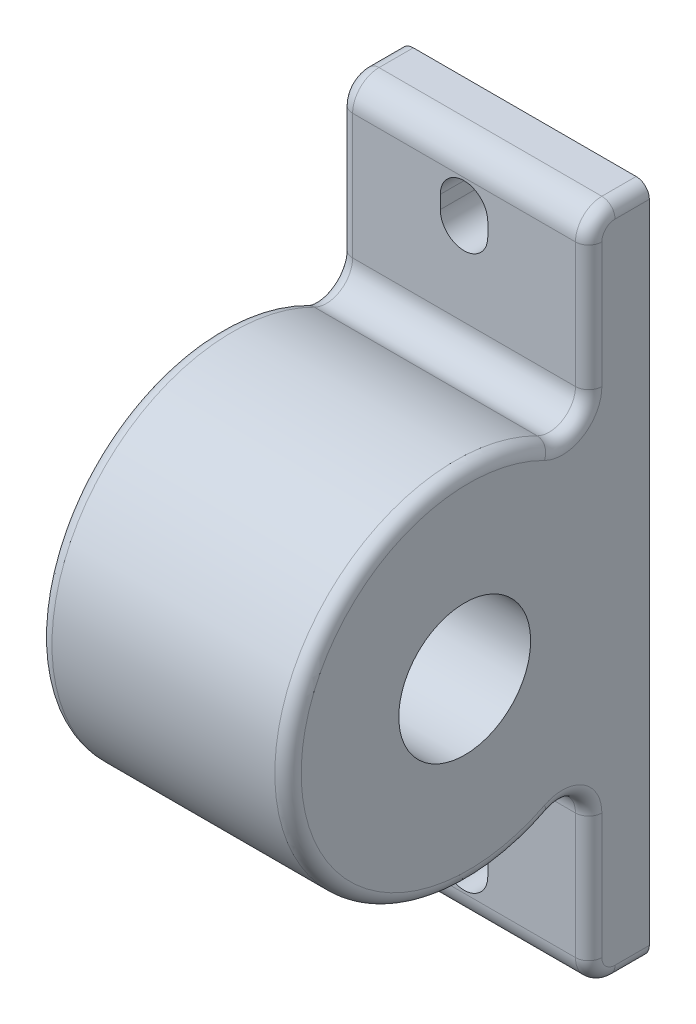
from build123d import *

# Parameters (mm, degrees)
SKETCH_1_W          = 94.5
SKETCH_1_H          = 255
EXTRUDE_1_DEPTH     = 137
SKETCH_2_OUTSIDE_W  = 199.902
SKETCH_2_OUTSIDE_H  = 317.902
CUT_EXTRUDE_1_DEPTH = 137
FILLET_1_R          = 10
FILLET_2_R          = 5
SKETCH_3_R          = 25
CUT_EXTRUDE_2_DEPTH = 210.655670133
CUT_EXTRUDE_3_DEPTH = 23


with BuildPart() as part:
    # 草图1 → 凸台-拉伸1 (new body)
    with BuildSketch(Plane.XY):
        Rectangle(SKETCH_1_W, SKETCH_1_H)
    extrude(amount=EXTRUDE_1_DEPTH)

    # 草图2 outside → 切除-拉伸1 (cut)
    with BuildSketch(Plane(origin=(47.25, 0, 0), x_dir=(0, 0, -1), z_dir=(1, 0, 0))):
        with Locations((-68.5, 0)):
            Rectangle(SKETCH_2_OUTSIDE_W, SKETCH_2_OUTSIDE_H)
        with BuildLine():
            Line((0, -127.5), (0, 127.5))
            Line((0, 127.5), (-23, 127.5))
            Line((-23, 127.5), (-23, 51.205468458))
            ThreePointArc((-23, 51.205468458), (-137, 0), (-23, -51.205468458))
            Line((-23, -51.205468458), (-23, -127.5))
            Line((-23, -127.5), (0, -127.5))
        make_face(mode=Mode.SUBTRACT)
    extrude(amount=-CUT_EXTRUDE_1_DEPTH, mode=Mode.SUBTRACT)

    # 圆角1
    fillet_1_edges = [part.edges().sort_by_distance(p)[0] for p in [
        (0, 127.5, 23),
        (0, -51.205468458, 23),
        (0, 51.205468458, 23),
        (0, -127.5, 23),
    ]]
    fillet(fillet_1_edges, radius=FILLET_1_R)

    # 圆角2
    fillet_2_edges = [part.edges().sort_by_distance(p)[0] for p in [
        (47.25, 127.5, 6.5),
        (-47.25, 127.5, 6.5),
        (47.25, -93.757142128, 23),
        (47.25, -127.5, 6.5),
        (47.25, 93.757142128, 23),
        (47.25, 0, 137),
        (47.25, -124.571067812, 20.071067812),
        (47.25, 124.571067812, 20.071067812),
        (-47.25, 93.757142128, 23),
        (-47.25, -93.757142128, 23),
        (-47.25, 0, 137),
        (-47.25, -127.5, 6.5),
        (-47.25, -124.571067812, 20.071067812),
        (-47.25, 124.571067812, 20.071067812),
        (47.25, 61.493048139, 27.766594318),
        (-47.25, 61.493048139, 27.766594318),
        (47.25, -61.493048139, 27.766594318),
        (-47.25, -61.493048139, 27.766594318),
    ]]
    fillet(fillet_2_edges, radius=FILLET_2_R)

    # 草图3 → 切除-拉伸2 (cut, through all)
    with BuildSketch(Plane(origin=(47.25, 0, 0), x_dir=(0, 0, -1), z_dir=(1, 0, 0))):
        with Locations((-70, 0)):
            Circle(SKETCH_3_R)
    extrude(amount=-CUT_EXTRUDE_2_DEPTH, mode=Mode.SUBTRACT)

    # 草图4 → 切除-拉伸3 (cut)
    with BuildSketch(Plane(origin=(0, 0, 0), x_dir=(-1, 0, 0), z_dir=(0, 0, -1))):
        with BuildLine():
            Line((9, 107.5), (9, 102.5))
            ThreePointArc((9, 102.5), (0, 93.5), (-9, 102.5))
            Line((-9, 102.5), (-9, 107.5))
            ThreePointArc((-9, 107.5), (0, 116.5), (9, 107.5))
        make_face()
        with BuildLine():
            Line((-9, -107.5), (-9, -102.5))
            ThreePointArc((-9, -102.5), (0, -93.5), (9, -102.5))
            Line((9, -102.5), (9, -107.5))
            ThreePointArc((9, -107.5), (0, -116.5), (-9, -107.5))
        make_face()
    extrude(amount=-CUT_EXTRUDE_3_DEPTH, mode=Mode.SUBTRACT)


solid = part.part
